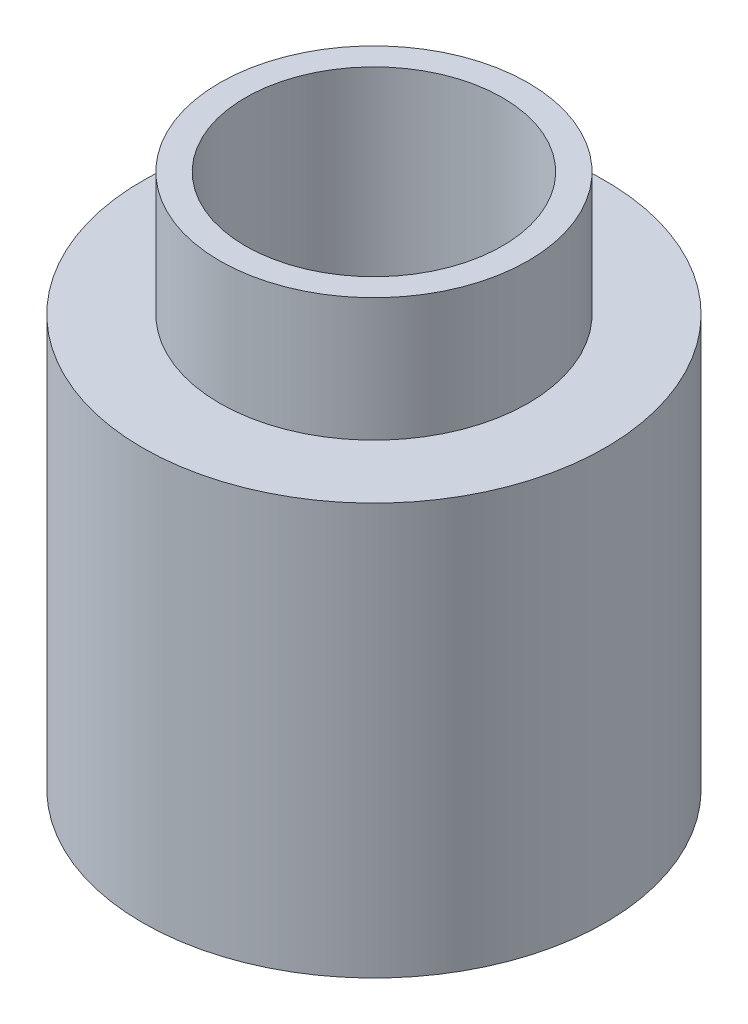
from build123d import *

# Parameters (mm, degrees)
SKETCH_1_R      = 2.25
SKETCH_1_R_2    = 1.25
EXTRUDE_1_DEPTH = 4
SKETCH_2_R      = 1.5
SKETCH_2_R_2    = 1.25
EXTRUDE_2_DEPTH = 1.2


with BuildPart() as part:
    # 草图1 → 凸台-拉伸1 (new body)
    with BuildSketch(Plane(origin=(0, 0, 0), x_dir=(1, 0, 0), z_dir=(0, 1, 0))):
        with Locations(Location((0, 0, 0), (0, 0, 270))):
            Circle(SKETCH_1_R)
        with Locations(Location((0, 0, 0), (0, 0, 270))):
            Circle(SKETCH_1_R_2, mode=Mode.SUBTRACT)
    extrude(amount=EXTRUDE_1_DEPTH)

    # 草图2 → 凸台-拉伸2 (add)
    with BuildSketch(Plane(origin=(0, 4, 0), x_dir=(1, 0, 0), z_dir=(0, 1, 0))):
        with Locations(Location((0, 0, 0), (0, 0, 270))):
            Circle(SKETCH_2_R)
        with Locations(Location((0, 0, 0), (0, 0, 270))):
            Circle(SKETCH_2_R_2, mode=Mode.SUBTRACT)
    extrude(amount=EXTRUDE_2_DEPTH)


solid = part.part
